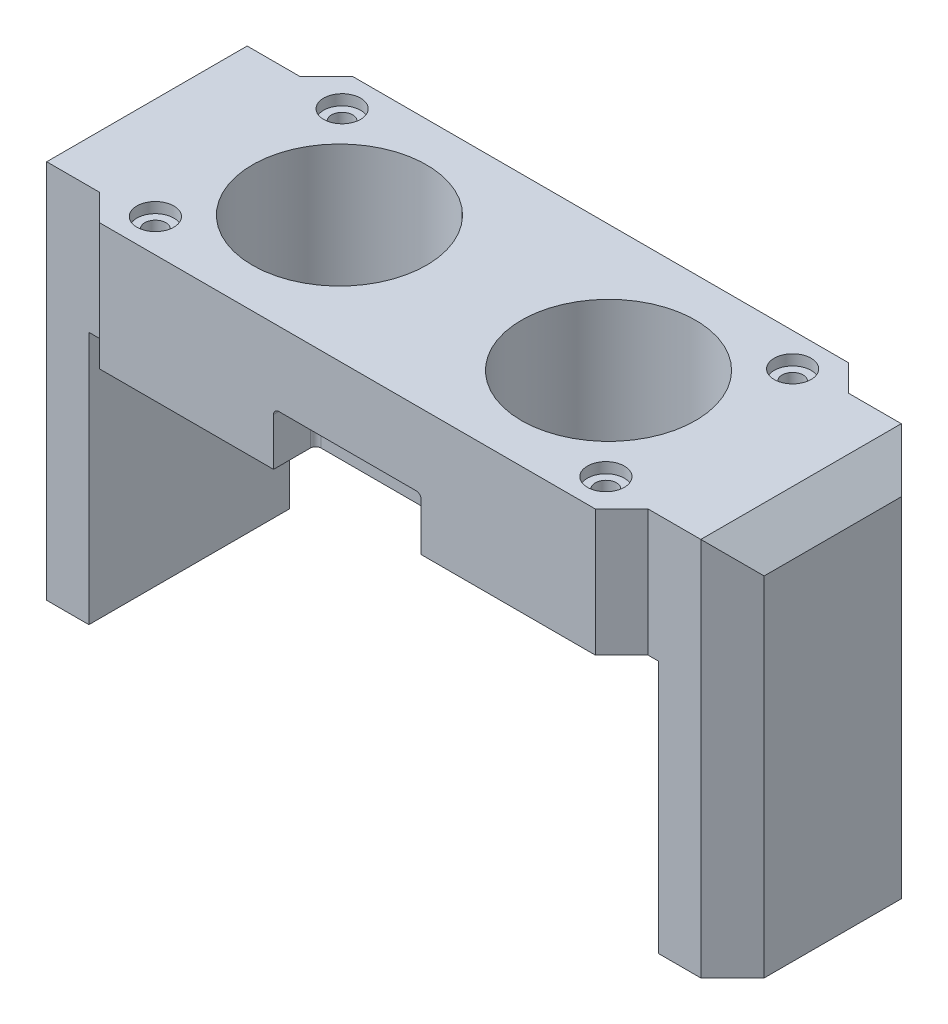
from build123d import *

# Parameters (mm, degrees)
SKETCH1_W                = 52
SKETCH1_H                = 24
SKETCH1_R                = 8.25
BOSS_EXTRUDE1_DEPTH      = 12
SKETCH2_R                = 1
CUT_EXTRUDE1_DEPTH       = 32.048349393
SKETCH3_R                = 1.75
CUT_EXTRUDE2_DEPTH       = 1
CUT_EXTRUDE3_DEPTH       = 5
FILLET3_R                = 0.5
CHAMFER1_SIZE            = 2.5
SKETCH5_W                = 19
SKETCH5_H                = 12
BOSS_EXTRUDE2_DEPTH      = 8
SKETCH6_W                = 7
SKETCH6_H                = 19
BOSS_EXTRUDE3_DEPTH      = 24
CHAMFER2_SIZE            = 3
CHAMFER2_OF_MIRROR1_SIZE = 3
SKETCH7_W                = 14
SKETCH7_H                = 8
CUT_EXTRUDE4_DEPTH       = 5
FILLET4_R                = 0.5


with BuildPart() as part:
    # Sketch1 → Boss-Extrude1 (new body)
    with BuildSketch(Plane(origin=(0, 0, 0), x_dir=(1, 0, 0), z_dir=(0, 1, 0))):
        Rectangle(SKETCH1_W, SKETCH1_H)
        with Locations(Location((12.75, 0, 0), (0, 0, 270))):
            Circle(SKETCH1_R, mode=Mode.SUBTRACT)
        with Locations(Location((-12.75, 0, 0), (0, 0, 270))):
            Circle(SKETCH1_R, mode=Mode.SUBTRACT)
    extrude(amount=BOSS_EXTRUDE1_DEPTH)

    # Sketch2 → Cut-Extrude1 (cut, through all)
    with BuildSketch(Plane(origin=(0, 12, 0), x_dir=(1, 0, 0), z_dir=(0, 1, 0))):
        with Locations(Location((-21.35, 8.85, 0), (0, 0, 270))):
            Circle(SKETCH2_R)
        with Locations(Location((21.35, 8.85, 0), (0, 0, 270))):
            Circle(SKETCH2_R)
        with Locations(Location((21.35, -8.85, 0), (0, 0, 270))):
            Circle(SKETCH2_R)
        with Locations(Location((-21.35, -8.85, 0), (0, 0, 270))):
            Circle(SKETCH2_R)
    extrude(amount=-CUT_EXTRUDE1_DEPTH, mode=Mode.SUBTRACT)

    # Sketch3 → Cut-Extrude2 (cut)
    with BuildSketch(Plane(origin=(0, 12, 0), x_dir=(1, 0, 0), z_dir=(0, 1, 0))):
        with Locations(Location((-21.35, 8.85, 0), (0, 0, 270))):
            Circle(SKETCH3_R)
        with Locations(Location((21.35, 8.85, 0), (0, 0, 270))):
            Circle(SKETCH3_R)
        with Locations(Location((21.35, -8.85, 0), (0, 0, 270))):
            Circle(SKETCH3_R)
        with Locations(Location((-21.35, -8.85, 0), (0, 0, 270))):
            Circle(SKETCH3_R)
    extrude(amount=-CUT_EXTRUDE2_DEPTH, mode=Mode.SUBTRACT)

    # Sketch4 → Cut-Extrude3 (cut)
    with BuildSketch(Plane.XZ):
        Polygon((-6, -5), (-6, -12), (6, -12), (6, -5), (0, -5), align=None)
    extrude(amount=-CUT_EXTRUDE3_DEPTH, mode=Mode.SUBTRACT)

    # Fillet3
    fillet3_edges = [part.edges().sort_by_distance(p)[0] for p in [
        (-6, 2.5, -5),
        (6, 5, -8.5),
        (6, 2.5, -5),
        (-6, 5, -8.5),
        (0, 5, -5),
    ]]
    fillet(fillet3_edges, radius=FILLET3_R)

    # Chamfer1
    chamfer1_edges = [part.edges().sort_by_distance(p)[0] for p in [
        (26, 6, 12),
        (-26, 6, 12),
        (-26, 6, -12),
        (26, 6, -12),
    ]]
    chamfer(chamfer1_edges, length=CHAMFER1_SIZE)

    # Sketch5 → Boss-Extrude2 (add)
    with BuildSketch(Plane.ZY.offset(26)):
        with Locations((0, 6)):
            Rectangle(SKETCH5_W, SKETCH5_H)
    boss_extrude2 = extrude(amount=BOSS_EXTRUDE2_DEPTH)

    # Sketch6 → Boss-Extrude3 (add)
    with BuildSketch(Plane.XZ):
        with Locations((-30.5, 0)):
            Rectangle(SKETCH6_W, SKETCH6_H)
    boss_extrude3 = extrude(amount=BOSS_EXTRUDE3_DEPTH)

    # Chamfer2
    chamfer2_edges = [part.edges().sort_by_distance(p)[0] for p in [
        (-34, -6, 9.5),
        (-34, 12, 0),
        (-34, -6, -9.5),
    ]]
    chamfer(chamfer2_edges, length=CHAMFER2_SIZE)

    # Mirror1: Boss-Extrude2, Boss-Extrude3 across plane
    add(boss_extrude2.mirror(Plane(origin=(0, 0, 0), x_dir=(0, 0, 1), z_dir=(1, 0, 0))))
    add(boss_extrude3.mirror(Plane(origin=(0, 0, 0), x_dir=(0, 0, 1), z_dir=(1, 0, 0))))

    # Chamfer2 of Mirror1
    chamfer2_of_mirror1_edges = [part.edges().sort_by_distance(p)[0] for p in [
        (34, -6, 9.5),
        (34, 12, 0),
        (34, -6, -9.5),
    ]]
    chamfer(chamfer2_of_mirror1_edges, length=CHAMFER2_OF_MIRROR1_SIZE)

    # Sketch7 → Cut-Extrude4 (cut)
    with BuildSketch(Plane.XZ):
        with Locations((0, 12)):
            Rectangle(SKETCH7_W, SKETCH7_H)
    extrude(amount=-CUT_EXTRUDE4_DEPTH, mode=Mode.SUBTRACT)

    # Fillet4
    fillet4_edges = [part.edges().sort_by_distance(p)[0] for p in [
        (-7, 2.5, 8),
        (7, 5, 10),
        (0, 5, 8),
        (-7, 5, 10),
        (7, 2.5, 8),
    ]]
    fillet(fillet4_edges, radius=FILLET4_R)


solid = part.part
